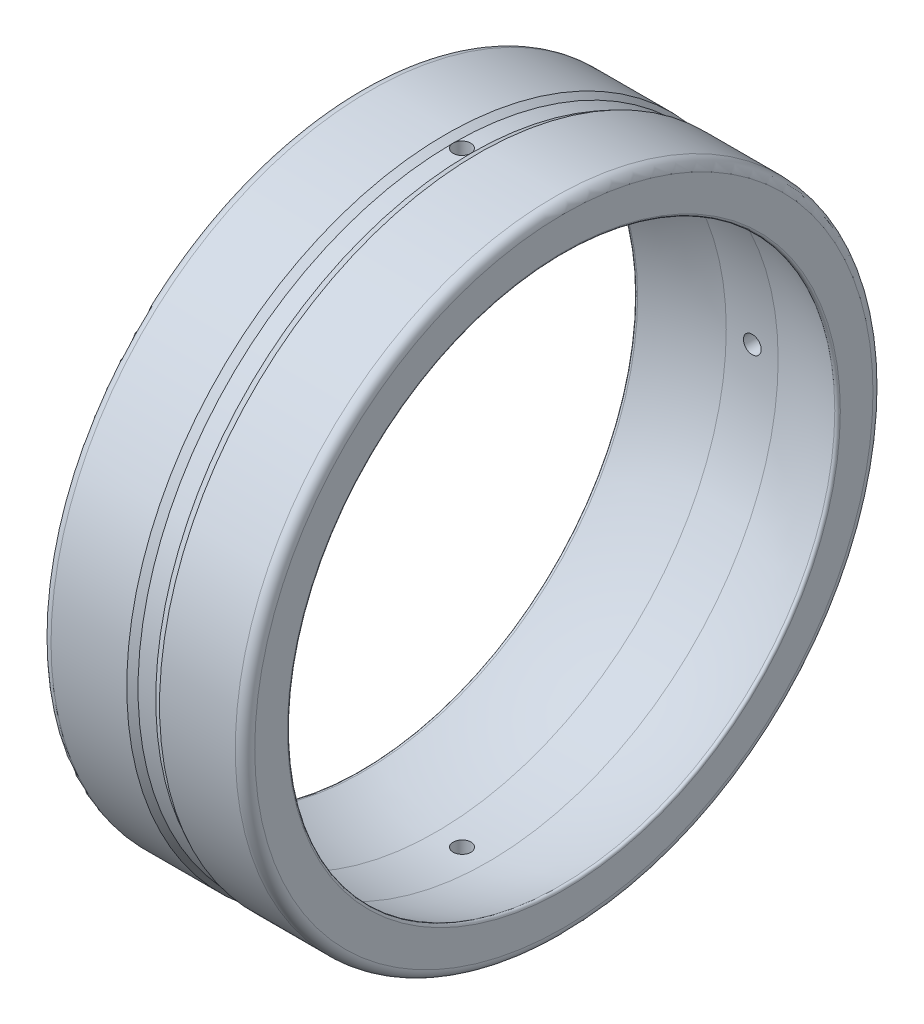
from build123d import *
from build123d.topology import SkipClean

# Parameters (mm, degrees)
FURO_DE_DI_METRO_2_0_2_1_D     = 2
FURO_DE_DI_METRO_2_0_2_1_DEPTH = 3.236794718
FURO_DE_DI_METRO_2_0_2_2_D     = 2
FURO_DE_DI_METRO_2_0_2_2_DEPTH = 3.236789945
FURO_DE_DI_METRO_2_0_2_3_D     = 2
FURO_DE_DI_METRO_2_0_2_3_DEPTH = 3.236794718
FILETE1_R                      = 1.1


with BuildPart() as part:
    # Esboço1 → Revolução1 (revolve)
    with BuildSketch(Plane.XY, mode=Mode.PRIVATE) as revolu_o1_sk:
        Polygon((0, 36), (0, 0), (23, 0), (23, 36), (13.35, 36), (12.5, 35.575), (10.5, 35.575), (9.65, 36), align=None)
    revolve(revolu_o1_sk.sketch.rotate(Axis((0, 0, 0), (1, 0, 0)), 270), axis=Axis((0, 0, 0), (1, 0, 0)))

    # Esboço2 → Corte-Revolução1 (revolve, cut)
    with BuildSketch(Plane.XY, mode=Mode.PRIVATE) as corte_revolu_o1_sk:
        with BuildLine():
            Line((0, 31.216119184), (0, 0))
            Line((0, 0), (23, 0))
            Line((23, 0), (23, 31.216119184))
            ThreePointArc((23, 31.216119184), (22.882921678, 30.990984238), (22.63137641, 30.957546905))
            ThreePointArc((22.63137641, 30.957546905), (18.589785335, 32.129476851), (14.43016208, 32.766197037))
            ThreePointArc((14.43016208, 32.766197037), (11.5, 32.778462752), (8.56983792, 32.766197037))
            ThreePointArc((8.56983792, 32.766197037), (4.410214665, 32.129476851), (0.36862359, 30.957546905))
            ThreePointArc((0.36862359, 30.957546905), (0.117078322, 30.990984238), (0, 31.216119184))
        make_face()
    revolve(corte_revolu_o1_sk.sketch.rotate(Axis((-0.0012614, 0, 0), (1, 0, 0)), 270), axis=Axis((-0.0012614, 0, 0), (1, 0, 0)), mode=Mode.SUBTRACT)

    # Furo de diâmetro Ø2.0 (2)1
    with Locations(Plane(origin=(0, 32.763205282, 0), x_dir=(-1, 0, 0), z_dir=(0, -1, 0))):
        with Locations((-11.5, 0)):
            Hole(FURO_DE_DI_METRO_2_0_2_1_D / 2, depth=FURO_DE_DI_METRO_2_0_2_1_DEPTH)

    # Furo de diâmetro Ø2.0 (2)2
    with Locations(Plane.XY.offset(-32.763210055)):
        with Locations((11.5, 0)):
            Hole(FURO_DE_DI_METRO_2_0_2_2_D / 2, depth=FURO_DE_DI_METRO_2_0_2_2_DEPTH)

    # Furo de diâmetro Ø2.0 (2)3
    with Locations(Plane(origin=(0, -32.763205282, 0), x_dir=(1, 0, 0), z_dir=(0, 1, 0))):
        with Locations((11.5, 0)):
            Hole(FURO_DE_DI_METRO_2_0_2_3_D / 2, depth=FURO_DE_DI_METRO_2_0_2_3_DEPTH)

    # Filete1
    filete1_edges = [part.edges().sort_by_distance(p)[0] for p in [
        (0, 0, 36),
        (23, 0, 36),
    ]]
    fillet(filete1_edges, radius=FILETE1_R)


solid = part.part
